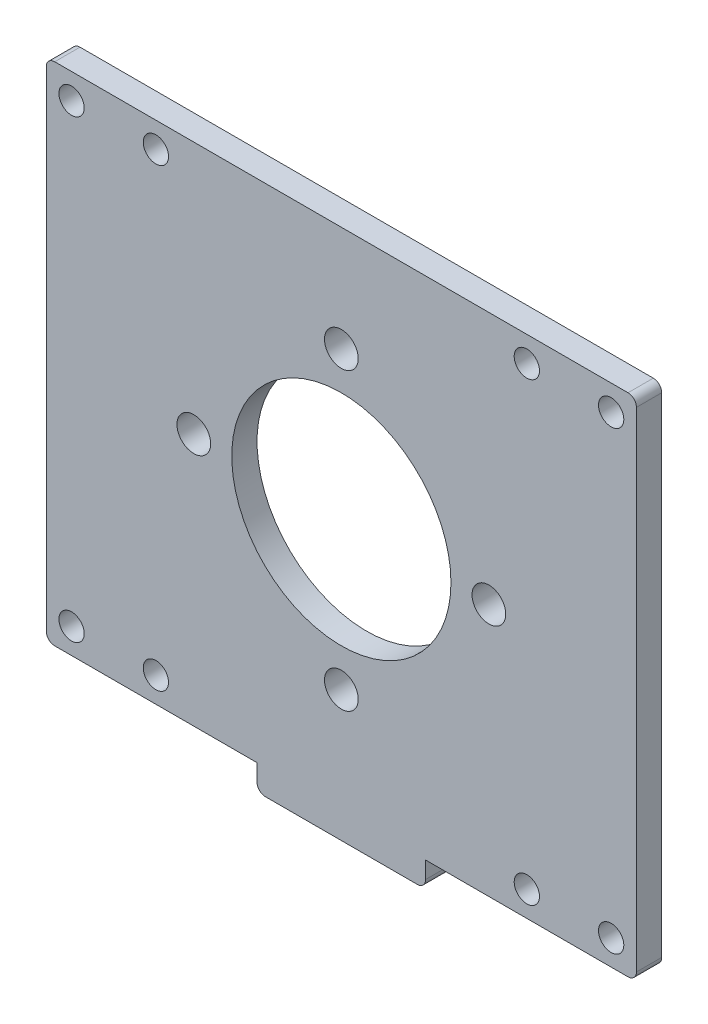
from build123d import *

# Parameters (mm, degrees)
SKETCH_1_W          = 70
SKETCH_1_H          = 60
EXTRUDE_1_DEPTH     = 3
SKETCH_2_R          = 13
CUT_EXTRUDE_1_DEPTH = 47.19523785
SKETCH_3_R          = 2
CUT_EXTRUDE_2_DEPTH = 47.19523785
SKETCH_4_W          = 20
SKETCH_4_H          = 3
EXTRUDE_2_DEPTH     = 3
SKETCH_5_R          = 1.5
CUT_EXTRUDE_3_DEPTH = 49.197510309
SKETCH_6_R          = 1.5
CUT_EXTRUDE_4_DEPTH = 49.197510309
FILLET_1_R          = 1


with BuildPart() as part:
    # 草图1 → 凸台-拉伸1 (new body)
    with BuildSketch(Plane.XY):
        Rectangle(SKETCH_1_W, SKETCH_1_H)
    extrude(amount=EXTRUDE_1_DEPTH)

    # 草图2 → 切除-拉伸1 (cut, through all)
    with BuildSketch(Plane.XY.offset(3)):
        Circle(SKETCH_2_R)
    extrude(amount=-CUT_EXTRUDE_1_DEPTH, mode=Mode.SUBTRACT)

    # 草图3 → 切除-拉伸2 (cut, through all)
    with BuildSketch(Plane.XY.offset(3)):
        with Locations((0, 17.5)):
            Circle(SKETCH_3_R)
        with Locations((-17.5, 0)):
            Circle(SKETCH_3_R)
        with Locations(Location((0, -17.5, 0), (0, 0, 180))):
            Circle(SKETCH_3_R)
        with Locations(Location((17.5, 0, 0), (0, 0, 180))):
            Circle(SKETCH_3_R)
    extrude(amount=-CUT_EXTRUDE_2_DEPTH, mode=Mode.SUBTRACT)

    # 草图4 → 凸台-拉伸2 (add)
    with BuildSketch(Plane.XY.offset(3)):
        with Locations((0, -31.5)):
            Rectangle(SKETCH_4_W, SKETCH_4_H)
    extrude(amount=-EXTRUDE_2_DEPTH)

    # 草图5 → 切除-拉伸3 (cut, through all)
    with BuildSketch(Plane.XY.offset(3)):
        with Locations((-32, 27)):
            Circle(SKETCH_5_R)
        with Locations((-22, 27)):
            Circle(SKETCH_5_R)
        with Locations(Location((22, 27, 0), (0, 0, 180))):
            Circle(SKETCH_5_R)
        with Locations(Location((32, 27, 0), (0, 0, 180))):
            Circle(SKETCH_5_R)
    extrude(amount=-CUT_EXTRUDE_3_DEPTH, mode=Mode.SUBTRACT)

    # 草图6 → 切除-拉伸4 (cut, through all)
    with BuildSketch(Plane.XY.offset(3)):
        with Locations((-32, -27)):
            Circle(SKETCH_6_R)
        with Locations((-22, -27)):
            Circle(SKETCH_6_R)
        with Locations(Location((22, -27, 0), (0, 0, 180))):
            Circle(SKETCH_6_R)
        with Locations(Location((32, -27, 0), (0, 0, 180))):
            Circle(SKETCH_6_R)
    extrude(amount=-CUT_EXTRUDE_4_DEPTH, mode=Mode.SUBTRACT)

    # 圆角1
    fillet_1_edges = [part.edges().sort_by_distance(p)[0] for p in [
        (-10, -33, 1.5),
        (10, -33, 1.5),
        (35, -30, 1.5),
        (-35, -30, 1.5),
        (-35, 30, 1.5),
        (35, 30, 1.5),
    ]]
    fillet(fillet_1_edges, radius=FILLET_1_R)


solid = part.part
